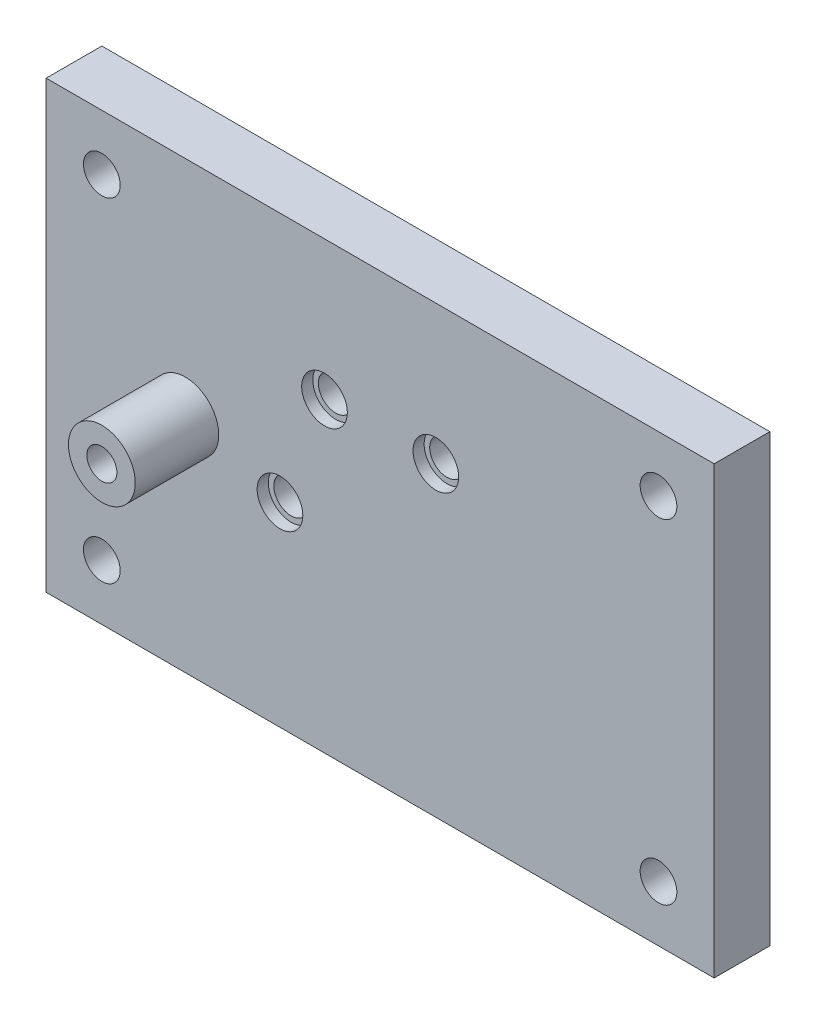
from build123d import *

# Parameters (mm, degrees)
SKETCH2_W                          = 120
SKETCH2_H                          = 80
BASE_PLATE_DEPTH                   = 10
PIVOT_PEDESTAL_START               = 10
SKETCH3_R                          = 6
PIVOT_PEDESTAL_DEPTH               = 15
SKETCH4_R                          = 2.7
PIVOT_CLEARANCE_DEPTH              = 25
SKETCH5_R                          = 3.1
LOCATOR_CLEARANCE_DEPTH            = 10
SKETCH6_R                          = 3.1
CUT_EXTRUDE3_DEPTH                 = 10
SKETCH7_R                          = 3.1
SIDE_LOCATOR_CLEARANCE_DEPTH       = 10
LOCATOR_SHOULDER_COUNTERBORE_START = 8
SKETCH8_R                          = 4.1
LOCATOR_SHOULDER_COUNTERBORE_DEPTH = 2
CUT_EXTRUDE6_START                 = 8
SKETCH9_R                          = 4.1
CUT_EXTRUDE6_DEPTH                 = 2
SIDE_SHOULDER_COUNTERBORE_START    = 8
SKETCH10_R                         = 4.1
SIDE_SHOULDER_COUNTERBORE_DEPTH    = 2
SKETCH11_R                         = 3.3
BENCH_MOUNT_M6_CLEARANCE_DEPTH     = 10
SKETCH12_R                         = 3.3
CUT_EXTRUDE9_DEPTH                 = 10
SKETCH13_R                         = 3.3
CUT_EXTRUDE10_DEPTH                = 10
SKETCH14_R                         = 3.3
CUT_EXTRUDE11_DEPTH                = 10


with BuildPart() as part:
    # Sketch2 → Base_plate (new body)
    with BuildSketch(Plane.XY):
        Rectangle(SKETCH2_W, SKETCH2_H)
    extrude(amount=BASE_PLATE_DEPTH)

    # Sketch3 → Pivot_pedestal (add)
    with BuildSketch(Plane.XY.offset(PIVOT_PEDESTAL_START)):
        with Locations(Location((-35, 0, 0), (0, 0, 180))):
            Circle(SKETCH3_R)
    extrude(amount=PIVOT_PEDESTAL_DEPTH)

    # Sketch4 → Pivot_clearance (cut)
    with BuildSketch(Plane.XY):
        with Locations((-35, 0)):
            Circle(SKETCH4_R)
    extrude(amount=PIVOT_CLEARANCE_DEPTH, mode=Mode.SUBTRACT)

    # Sketch5 → Locator_clearance (cut)
    with BuildSketch(Plane.XY):
        with Locations((-10, 15)):
            Circle(SKETCH5_R)
    extrude(amount=LOCATOR_CLEARANCE_DEPTH, mode=Mode.SUBTRACT)

    # Sketch6 → Cut-Extrude3 (cut)
    with BuildSketch(Plane.XY):
        with Locations((10, 15)):
            Circle(SKETCH6_R)
    extrude(amount=CUT_EXTRUDE3_DEPTH, mode=Mode.SUBTRACT)

    # Sketch7 → Side_locator_clearance (cut)
    with BuildSketch(Plane.XY):
        with Locations((-18, -5)):
            Circle(SKETCH7_R)
    extrude(amount=SIDE_LOCATOR_CLEARANCE_DEPTH, mode=Mode.SUBTRACT)

    # Sketch8 → Locator_shoulder_counterbore (cut)
    with BuildSketch(Plane.XY.offset(LOCATOR_SHOULDER_COUNTERBORE_START)):
        with Locations((-10, 15)):
            Circle(SKETCH8_R)
    extrude(amount=LOCATOR_SHOULDER_COUNTERBORE_DEPTH, mode=Mode.SUBTRACT)

    # Sketch9 → Cut-Extrude6 (cut)
    with BuildSketch(Plane.XY.offset(CUT_EXTRUDE6_START)):
        with Locations((10, 15)):
            Circle(SKETCH9_R)
    extrude(amount=CUT_EXTRUDE6_DEPTH, mode=Mode.SUBTRACT)

    # Sketch10 → Side_shoulder_counterbore (cut)
    with BuildSketch(Plane.XY.offset(SIDE_SHOULDER_COUNTERBORE_START)):
        with Locations((-18, -5)):
            Circle(SKETCH10_R)
    extrude(amount=SIDE_SHOULDER_COUNTERBORE_DEPTH, mode=Mode.SUBTRACT)

    # Sketch11 → Bench_mount_M6_clearance (cut)
    with BuildSketch(Plane.XY):
        with Locations((-50, -30)):
            Circle(SKETCH11_R)
    extrude(amount=BENCH_MOUNT_M6_CLEARANCE_DEPTH, mode=Mode.SUBTRACT)

    # Sketch12 → Cut-Extrude9 (cut)
    with BuildSketch(Plane.XY):
        with Locations((-50, 30)):
            Circle(SKETCH12_R)
    extrude(amount=CUT_EXTRUDE9_DEPTH, mode=Mode.SUBTRACT)

    # Sketch13 → Cut-Extrude10 (cut)
    with BuildSketch(Plane.XY):
        with Locations((50, -30)):
            Circle(SKETCH13_R)
    extrude(amount=CUT_EXTRUDE10_DEPTH, mode=Mode.SUBTRACT)

    # Sketch14 → Cut-Extrude11 (cut)
    with BuildSketch(Plane.XY):
        with Locations((50, 30)):
            Circle(SKETCH14_R)
    extrude(amount=CUT_EXTRUDE11_DEPTH, mode=Mode.SUBTRACT)


solid = part.part
